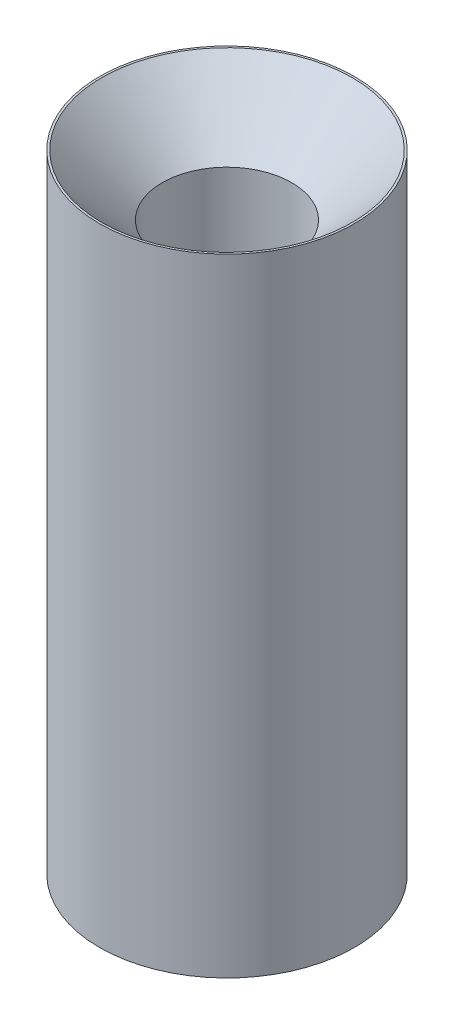
from build123d import *

# Parameters (mm, degrees)
SKETCH1_R                                       = 3.05
BOSS_EXTRUDE1_DEPTH                             = 15
CSK_FOR_M3_FLAT_HEAD_MACHINE_SCREW1_D           = 3.1
CSK_FOR_M3_FLAT_HEAD_MACHINE_SCREW1_DEPTH       = 54.068666041
CSK_FOR_M3_FLAT_HEAD_MACHINE_SCREW1_CSINK_D     = 6
CSK_FOR_M3_FLAT_HEAD_MACHINE_SCREW1_CSINK_ANGLE = 90
CSK_FOR_M3_FLAT_HEAD_MACHINE_SCREW1_TIP         = 0.931333959


with BuildPart() as part:
    # Sketch1 → Boss-Extrude1 (new body)
    with BuildSketch(Plane(origin=(0, 0, 0), x_dir=(1, 0, 0), z_dir=(0, 1, 0))):
        with Locations(Location((0, 0, 0), (0, 0, 270))):
            Circle(SKETCH1_R)
    extrude(amount=BOSS_EXTRUDE1_DEPTH)

    # CSK for M3 Flat Head Machine Screw1
    with Locations(Plane(origin=(0, 15, 0), x_dir=(1, 0, 0), z_dir=(0, 1, 0))):
        with Locations((0, 0)):
            CounterSinkHole(CSK_FOR_M3_FLAT_HEAD_MACHINE_SCREW1_D / 2, CSK_FOR_M3_FLAT_HEAD_MACHINE_SCREW1_CSINK_D / 2, depth=CSK_FOR_M3_FLAT_HEAD_MACHINE_SCREW1_DEPTH, counter_sink_angle=CSK_FOR_M3_FLAT_HEAD_MACHINE_SCREW1_CSINK_ANGLE)
            with Locations((0, 0, -(CSK_FOR_M3_FLAT_HEAD_MACHINE_SCREW1_DEPTH + CSK_FOR_M3_FLAT_HEAD_MACHINE_SCREW1_TIP / 2))):  # 118° drill point
                Cone(0, CSK_FOR_M3_FLAT_HEAD_MACHINE_SCREW1_D / 2, CSK_FOR_M3_FLAT_HEAD_MACHINE_SCREW1_TIP, mode=Mode.SUBTRACT)


solid = part.part
